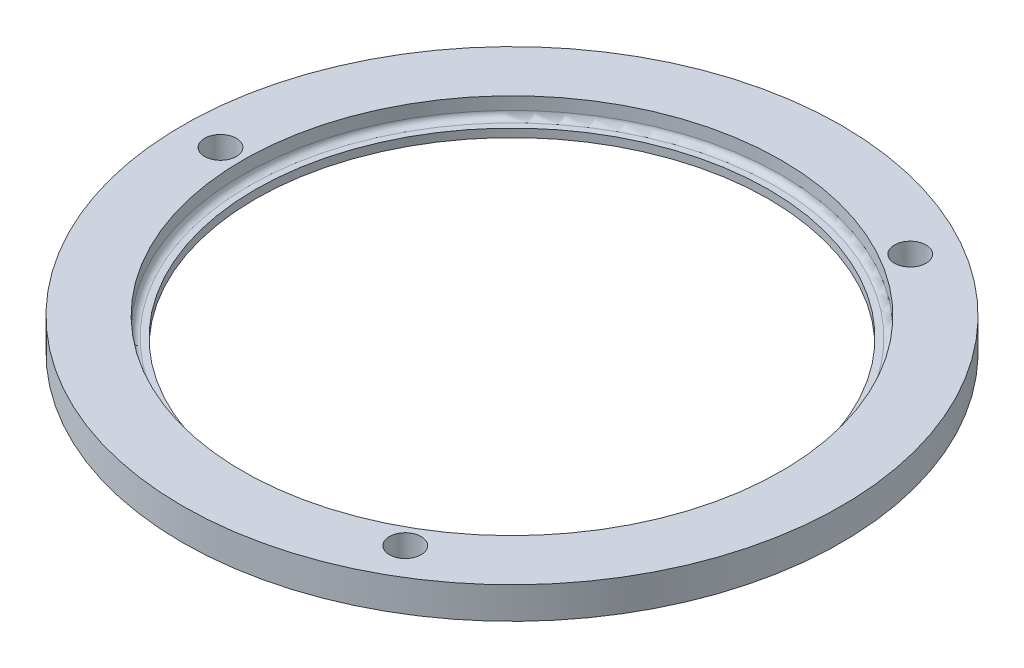
from build123d import *

# Parameters (mm, degrees)
FILETE1_R             = 1
FILETE2_R             = 2
ESBO_O2_R             = 2.5
CORTE_EXTRUS_O1_DEPTH = 74.773875806


with BuildPart() as part:
    # Esboço1 → Revolução1 (revolve)
    with BuildSketch(Plane.XY, mode=Mode.PRIVATE) as revolu_o1_sk:
        with BuildLine():
            Line((52, 4.149133087), (52, -0.850866913))
            ThreePointArc((52, -0.850866913), (47.161295888, -1.704708432), (42.5, -0.150866913))
            Line((42.5, -0.150866913), (40.5, -0.150866913))
            Line((40.5, -0.150866913), (40.5, 1.149133087))
            Line((40.5, 1.149133087), (42.5, 1.149133087))
            Line((42.5, 1.149133087), (42.5, 4.149133087))
            Line((42.5, 4.149133087), (52, 4.149133087))
        make_face()
    revolve(revolu_o1_sk.sketch.rotate(Axis((0, -12.642652583, 0), (0, 1, 0)), 90), axis=Axis((0, -12.642652583, 0), (0, 1, 0)))

    # Filete1
    filete1_edges = [part.edges().sort_by_distance(p)[0] for p in [
        (0, 1.149133087, 42.5),
    ]]
    fillet(filete1_edges, radius=FILETE1_R)

    # Filete2
    filete2_edges = [part.edges().sort_by_distance(p)[0] for p in [
        (0, -0.150866913, 42.5),
    ]]
    fillet(filete2_edges, radius=FILETE2_R)

    # Esboço2 → Corte-extrusão1 (cut, through all)
    with BuildSketch(Plane(origin=(0, 4.149133087, 0), x_dir=(1, 0, 0), z_dir=(0, 1, 0))):
        with Locations(Location((-46, 0, 0), (0, 0, 270))):
            Circle(ESBO_O2_R)
        with Locations(Location((23, 39.837168574, 0), (0, 0, 270))):
            Circle(ESBO_O2_R)
        with Locations(Location((23, -39.837168574, 0), (0, 0, 270))):
            Circle(ESBO_O2_R)
    extrude(amount=-CORTE_EXTRUS_O1_DEPTH, mode=Mode.SUBTRACT)


solid = part.part
